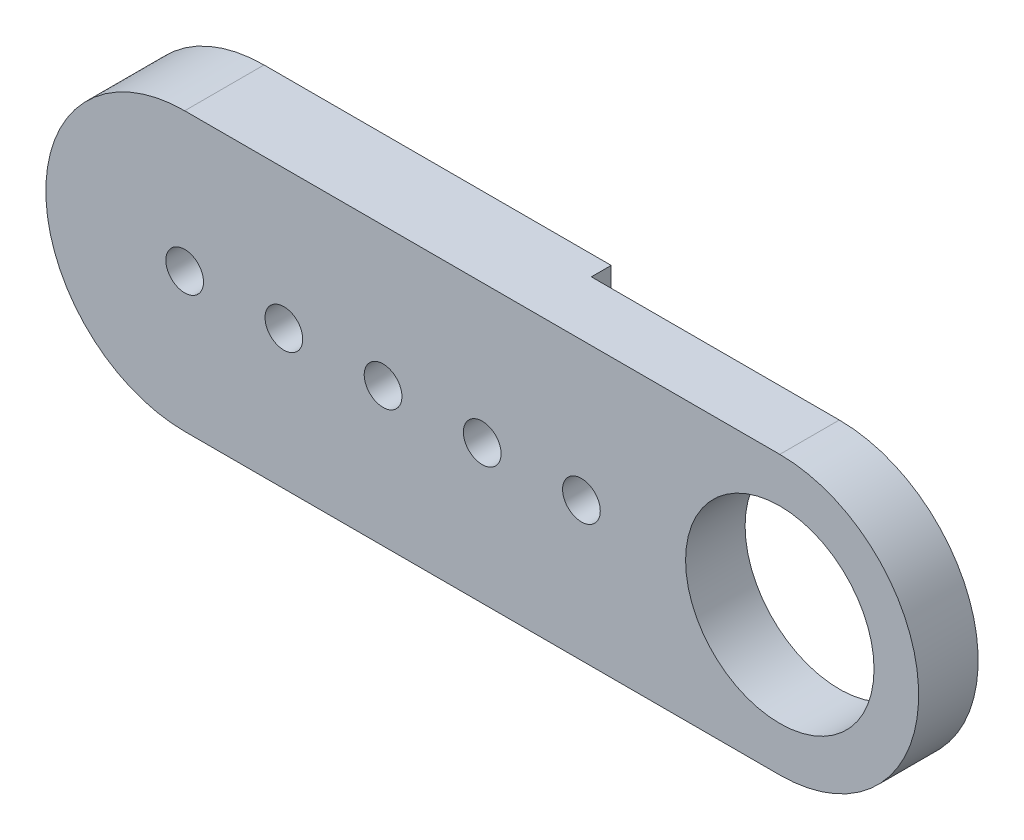
from build123d import *

# Parameters (mm, degrees)
ESQUISSE1_R             = 9.5
ESQUISSE1_R_2           = 1.9
BOSS_EXTRU_1_DEPTH      = 8
ESQUISSE3_W             = 39
ESQUISSE3_H             = 28
ENL_V_MAT_EXTRU_1_DEPTH = 2


with BuildPart() as part:
    # Esquisse1 → Boss.-Extru.1 (new body)
    with BuildSketch(Plane.XY):
        with BuildLine():
            Line((0, 14), (-60, 14))
            ThreePointArc((-60, 14), (-74, 0), (-60, -14))
            Line((-60, -14), (0, -14))
            ThreePointArc((0, -14), (14, 0), (0, 14))
        make_face()
        Circle(ESQUISSE1_R, mode=Mode.SUBTRACT)
        with Locations((-60, 0)):
            Circle(ESQUISSE1_R_2, mode=Mode.SUBTRACT)
        with Locations((-50, 0)):
            Circle(ESQUISSE1_R_2, mode=Mode.SUBTRACT)
        with Locations((-40, 0)):
            Circle(ESQUISSE1_R_2, mode=Mode.SUBTRACT)
        with Locations((-30, 0)):
            Circle(ESQUISSE1_R_2, mode=Mode.SUBTRACT)
        with Locations((-20, 0)):
            Circle(ESQUISSE1_R_2, mode=Mode.SUBTRACT)
    extrude(amount=BOSS_EXTRU_1_DEPTH)

    # Esquisse3 → Enlèv. mat.-Extru.1 (cut)
    with BuildSketch(Plane(origin=(0, 0, 0), x_dir=(-1, 0, 0), z_dir=(0, 0, -1))):
        with Locations((5.5, 0)):
            Rectangle(ESQUISSE3_W, ESQUISSE3_H)
    extrude(amount=-ENL_V_MAT_EXTRU_1_DEPTH, mode=Mode.SUBTRACT)


solid = part.part
